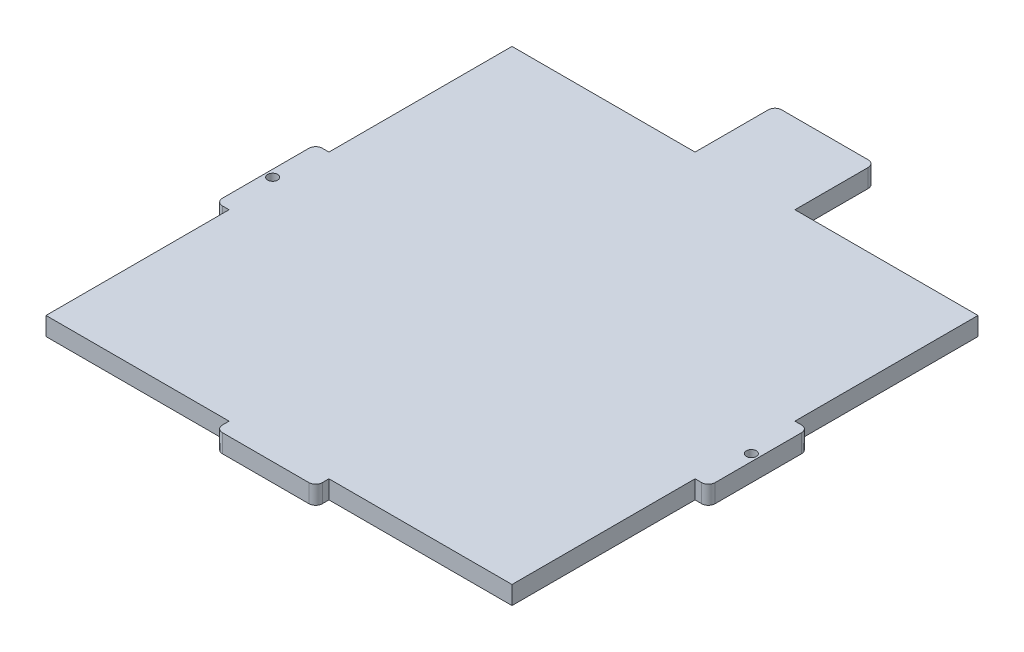
from build123d import *

# Parameters (mm, degrees)
SKETCH1_R           = 1.5
BOSS_EXTRUDE1_DEPTH = 5.5
FILLET1_R           = 2


with BuildPart() as part:
    # Sketch1 → Boss-Extrude1 (new body)
    with BuildSketch(Plane(origin=(0, 0, 0), x_dir=(1, 0, 0), z_dir=(0, 1, 0))):
        Polygon((0, 85), (0, 140), (55, 140), (55, 164), (85, 164), (85, 140), (140, 140), (140, 85), (144, 85), (144, 55), (140, 55), (140, 0), (85, 0), (85, -4), (55, -4), (55, 0), (0, 0), (0, 55), (-4, 55), (-4, 85), align=None)
        with Locations(Location((-1.9, 70, 0), (0, 0, 270))):
            Circle(SKETCH1_R, mode=Mode.SUBTRACT)
        with Locations(Location((141.9, 70, 0), (0, 0, 270))):
            Circle(SKETCH1_R, mode=Mode.SUBTRACT)
    extrude(amount=BOSS_EXTRUDE1_DEPTH)

    # Fillet1
    fillet1_edges = [part.edges().sort_by_distance(p)[0] for p in [
        (-4, 2.75, -55),
        (-4, 2.75, -85),
        (55, 2.75, -164),
        (85, 2.75, -164),
        (144, 2.75, -85),
        (144, 2.75, -55),
        (85, 2.75, 4),
        (55, 2.75, 4),
    ]]
    fillet(fillet1_edges, radius=FILLET1_R)


solid = part.part
